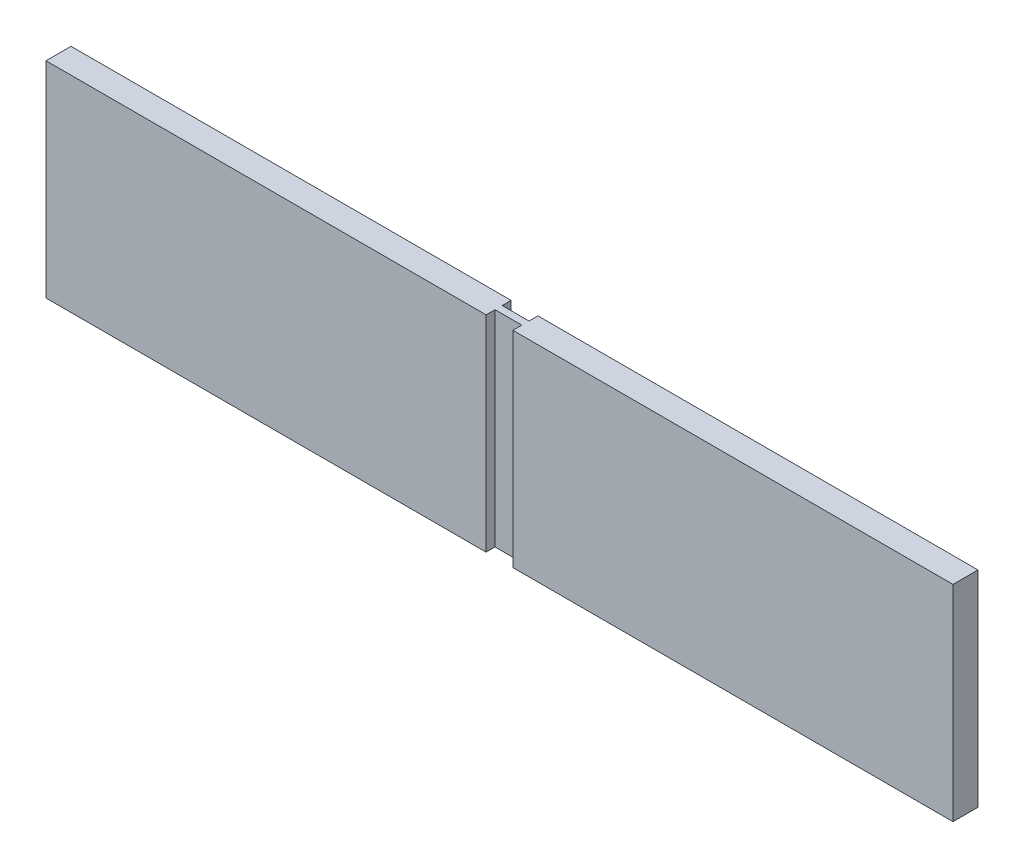
from build123d import *

# Parameters (mm, degrees)
SKETCH1_W           = 101.5
SKETCH1_H           = 23
BOSS_EXTRUDE1_DEPTH = 2.8
SKETCH2_W           = 3
SKETCH2_H           = 1
CUT_EXTRUDE1_DEPTH  = 33
SKETCH3_W           = 3
SKETCH3_H           = 1
CUT_EXTRUDE2_DEPTH  = 33


with BuildPart() as part:
    # Sketch1 → Boss-Extrude1 (new body)
    with BuildSketch(Plane.XY):
        with Locations((50.75, 11.5)):
            Rectangle(SKETCH1_W, SKETCH1_H)
    extrude(amount=BOSS_EXTRUDE1_DEPTH)

    # Sketch2 → Cut-Extrude1 (cut)
    with BuildSketch(Plane(origin=(0, 23, 0), x_dir=(1, 0, 0), z_dir=(0, 1, 0))):
        with Locations((50.75, -0.5)):
            Rectangle(SKETCH2_W, SKETCH2_H)
    extrude(amount=-CUT_EXTRUDE1_DEPTH, mode=Mode.SUBTRACT)

    # Sketch3 → Cut-Extrude2 (cut)
    with BuildSketch(Plane(origin=(0, 23, 0), x_dir=(1, 0, 0), z_dir=(0, 1, 0))):
        with Locations((50.75, -2.3)):
            Rectangle(SKETCH3_W, SKETCH3_H)
    extrude(amount=-CUT_EXTRUDE2_DEPTH, mode=Mode.SUBTRACT)


solid = part.part
